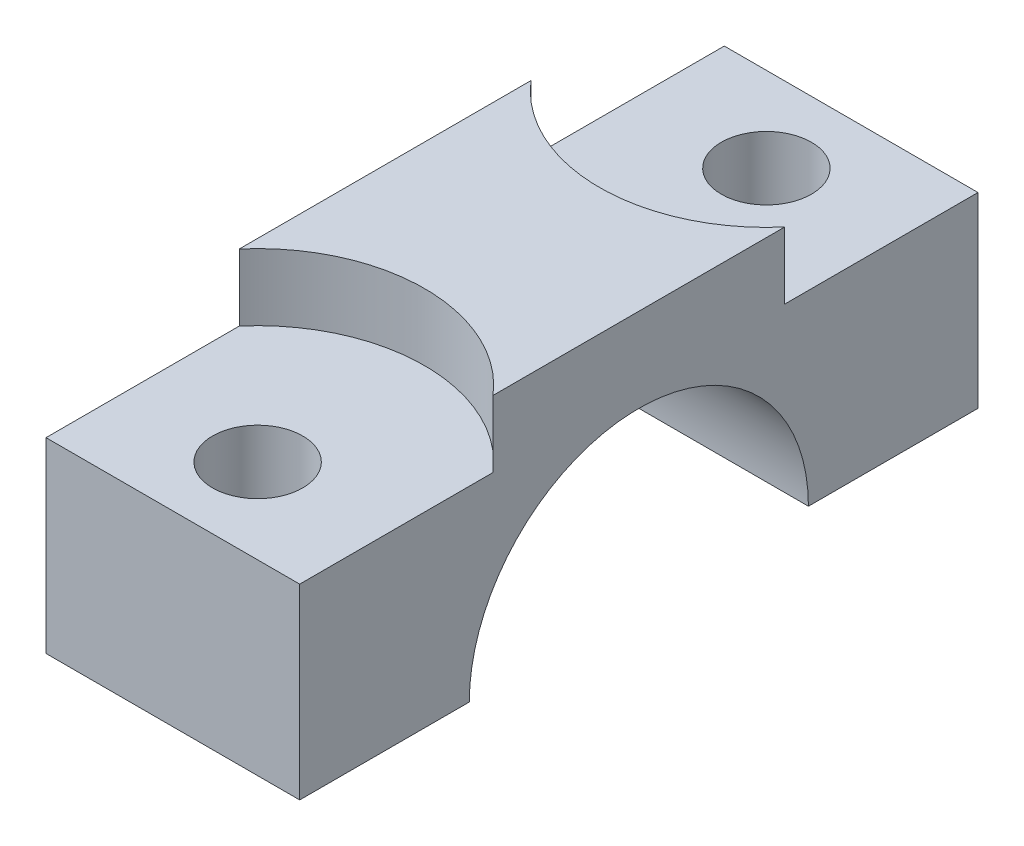
from build123d import *

# Parameters (mm, degrees)
BOSS_EXTRUDE1_DEPTH                           = 9.5
CBORE_FOR_M12_HEX_HEAD_CAP_SCREW1_D           = 6.75
CBORE_FOR_M12_HEX_HEAD_CAP_SCREW1_CBORE_D     = 25
CBORE_FOR_M12_HEX_HEAD_CAP_SCREW1_CBORE_DEPTH = 5


with BuildPart() as part:
    # Sketch1 → Boss-Extrude1 (new, symmetric)
    with BuildSketch(Plane(origin=(0, 0, 0), x_dir=(0, 0, -1), z_dir=(1, 0, 0))):
        with BuildLine():
            Line((25.4, 19), (-25.4, 19))
            Line((-25.4, 19), (-25.4, 0))
            Line((-25.4, 0), (-12.7, 0))
            ThreePointArc((-12.7, 0), (0, 12.7), (12.7, 0))
            Line((12.7, 0), (25.4, 0))
            Line((25.4, 0), (25.4, 19))
        make_face()
    extrude(amount=BOSS_EXTRUDE1_DEPTH, both=True)

    # CBORE for M12 Hex Head Cap Screw1 (through all)
    with Locations(Plane(origin=(0, 19, 0), x_dir=(1, 0, 0), z_dir=(0, 1, 0))):
        with Locations((0, 19.05), (0, -19.05)):
            CounterBoreHole(CBORE_FOR_M12_HEX_HEAD_CAP_SCREW1_D / 2, CBORE_FOR_M12_HEX_HEAD_CAP_SCREW1_CBORE_D / 2, CBORE_FOR_M12_HEX_HEAD_CAP_SCREW1_CBORE_DEPTH)


solid = part.part
